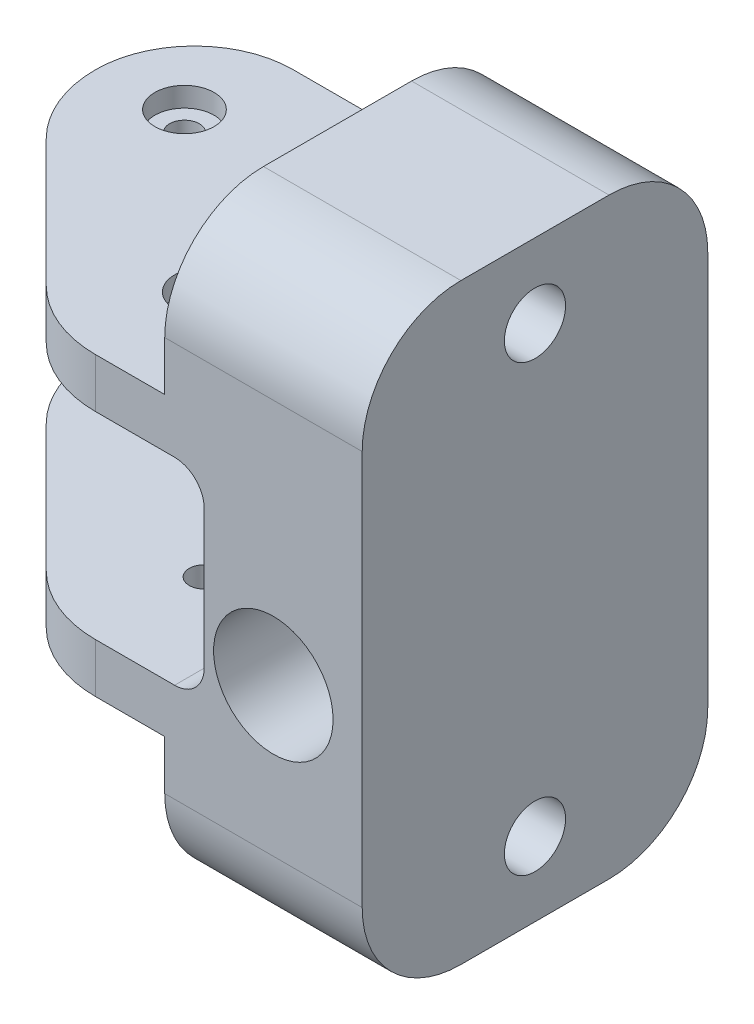
from build123d import *

# Parameters (mm, degrees)
EXTRUDE_1_DEPTH      = 60
SKETCH_2_W           = 32
SKETCH_2_H           = 15
CUT_EXTRUDE_1_DEPTH  = 60
SKETCH_3_R           = 3
CUT_EXTRUDE_2_DEPTH  = 30
CUT_EXTRUDE_3_DEPTH  = 30
CUT_EXTRUDE_4_DEPTH  = 50
SKETCH_6_R           = 5
CUT_EXTRUDE_5_DEPTH  = 50
CUT_EXTRUDE_6_DEPTH  = 50
SKETCH_8_W           = 21
SKETCH_8_H           = 14
SKETCH_8_H_2         = 3
CUT_EXTRUDE_7_DEPTH  = 13
SKETCH_9_W           = 21
SKETCH_9_H           = 3
CUT_EXTRUDE_8_DEPTH  = 13
CUT_EXTRUDE_10_DEPTH = 50
CUT_EXTRUDE_11_DEPTH = 50
SKETCH_15_R          = 1.51
CUT_EXTRUDE_14_DEPTH = 100
CUT_EXTRUDE_START    = -100
SKETCH_16_R          = 1.51
CUT_EXTRUDE_15_DEPTH = 100
SKETCH_17_R          = 1.51
CUT_EXTRUDE_16_DEPTH = 100
SKETCH_18_R          = 1.51
CUT_EXTRUDE_17_DEPTH = 100
SKETCH_21_R          = 3
CUT_EXTRUDE_18_DEPTH = 2
CUT_EXTRUDE_START_2  = -2
SKETCH_22_R          = 3
CUT_EXTRUDE_19_DEPTH = 2
SKETCH_23_R          = 5.05
CUT_EXTRUDE_20_DEPTH = 100
SKETCH_24_R          = 3.05
CUT_EXTRUDE_21_DEPTH = 100
SKETCH_25_R          = 3.05
CUT_EXTRUDE_22_DEPTH = 30
SKETCH_27_R          = 6.05
CUT_EXTRUDE_23_DEPTH = 50
SKETCH_28_R          = 3.05
CUT_EXTRUDE_24_DEPTH = 100
SKETCH_29_R          = 3.05
CUT_EXTRUDE_25_DEPTH = 100
SKETCH_30_R          = 6.05
CUT_EXTRUDE_26_DEPTH = 100
SKETCH_31_W          = 60.79957539
SKETCH_31_H          = 66.624791199
CUT_EXTRUDE_27_DEPTH = 100
SKETCH_32_W          = 19.915773323
SKETCH_32_H          = 3
CUT_EXTRUDE_28_DEPTH = 100
SKETCH_33_R          = 3.05
EXTRUDE_2_DEPTH      = 2
SKETCH_34_R          = 3.1
CUT_EXTRUDE_29_DEPTH = 30


with BuildPart() as part:
    # 草图1 → 凸台-拉伸1 (new body)
    with BuildSketch(Plane(origin=(0, 0, 0), x_dir=(1, 0, 0), z_dir=(0, 1, 0))):
        Polygon((-25, -17.5), (5, -17.5), (25, 2.5), (25, 17.5), (-25, 17.5), align=None)
    extrude_1 = extrude(amount=EXTRUDE_1_DEPTH)

    # 草图2 → 切除-拉伸1 (cut)
    with BuildSketch(Plane(origin=(0, 0, -17.5), x_dir=(-1, 0, 0), z_dir=(0, 0, -1))):
        with Locations((-9, 52.5)):
            Rectangle(SKETCH_2_W, SKETCH_2_H)
        with Locations((-9, 7.5)):
            Rectangle(SKETCH_2_W, SKETCH_2_H)
    cut_extrude_1 = extrude(amount=-CUT_EXTRUDE_1_DEPTH, mode=Mode.SUBTRACT)

    # 草图3 → 切除-拉伸2 (cut)
    with BuildSketch(Plane.ZY.offset(25)):
        with Locations((0, 52.5)):
            Circle(SKETCH_3_R)
        with Locations((0, 7.5)):
            Circle(SKETCH_3_R)
    extrude(amount=-CUT_EXTRUDE_2_DEPTH, mode=Mode.SUBTRACT)

    # 草图4 → 切除-拉伸3 (cut)
    with BuildSketch(Plane.ZY.offset(25)):
        with BuildLine():
            Line((-7.5, 60), (-17.5, 60))
            Line((-17.5, 60), (-17.5, 50))
            ThreePointArc((-17.5, 50), (-14.571067812, 57.071067812), (-7.5, 60))
        make_face()
        with BuildLine():
            Line((17.5, 60), (7.5, 60))
            ThreePointArc((7.5, 60), (14.571067812, 57.071067812), (17.5, 50))
            Line((17.5, 50), (17.5, 60))
        make_face()
        with BuildLine():
            Line((17.5, 0), (17.5, 10))
            ThreePointArc((17.5, 10), (14.571067812, 2.928932188), (7.5, 0))
            Line((7.5, 0), (17.5, 0))
        make_face()
        with BuildLine():
            ThreePointArc((-7.5, 0), (-14.571067812, 2.928932188), (-17.5, 10))
            Line((-17.5, 10), (-17.5, 0))
            Line((-17.5, 0), (-7.5, 0))
        make_face()
    extrude(amount=-CUT_EXTRUDE_3_DEPTH, mode=Mode.SUBTRACT)

    # 草图5 → 切除-拉伸4 (cut)
    with BuildSketch(Plane(origin=(0, 0, -17.5), x_dir=(-1, 0, 0), z_dir=(0, 0, -1))):
        with BuildLine():
            Line((5, 37), (5, 23))
            ThreePointArc((5, 23), (8, 20), (11, 23))
            Line((11, 23), (11, 37))
            ThreePointArc((11, 37), (8, 40), (5, 37))
        make_face()
    cut_extrude_4 = extrude(amount=-CUT_EXTRUDE_4_DEPTH, mode=Mode.SUBTRACT)

    # 草图6 → 切除-拉伸5 (cut)
    with BuildSketch(Plane(origin=(0, 0, -17.5), x_dir=(-1, 0, 0), z_dir=(0, 0, -1))):
        with Locations((18, 25)):
            Circle(SKETCH_6_R)
    extrude(amount=-CUT_EXTRUDE_5_DEPTH, mode=Mode.SUBTRACT)

    # 草图7 → 切除-拉伸6 (cut)
    with BuildSketch(Plane(origin=(0, 0, -17.5), x_dir=(-1, 0, 0), z_dir=(0, 0, -1))):
        with BuildLine():
            ThreePointArc((-5, 37), (-5.878679656, 39.121320344), (-8, 40))
            Line((-8, 40), (-25, 40))
            Line((-25, 40), (-25, 20))
            Line((-25, 20), (-8, 20))
            ThreePointArc((-8, 20), (-5.878679656, 20.878679656), (-5, 23))
            Line((-5, 23), (-5, 30))
            Line((-5, 30), (-5, 37))
        make_face()
    cut_extrude_6 = extrude(amount=-CUT_EXTRUDE_6_DEPTH, mode=Mode.SUBTRACT)

    # 草图8 → 切除-拉伸7 (cut)
    with BuildSketch(Plane(origin=(5, 0, 0), x_dir=(0, 0, -1), z_dir=(1, 0, 0))):
        with Locations((-7, 30)):
            Rectangle(SKETCH_8_W, SKETCH_8_H)
        with Locations((-7, 38.5)):
            Rectangle(SKETCH_8_W, SKETCH_8_H_2)
        with Locations((-7, 21.5)):
            Rectangle(SKETCH_8_W, SKETCH_8_H_2)
    cut_extrude_7 = extrude(amount=-CUT_EXTRUDE_7_DEPTH, mode=Mode.SUBTRACT)

    # 草图9 → 切除-拉伸8 (cut)
    with BuildSketch(Plane.ZY.offset(-5)):
        with Locations((7, 38.5)):
            Rectangle(SKETCH_9_W, SKETCH_9_H)
        with Locations((7, 21.5)):
            Rectangle(SKETCH_9_W, SKETCH_9_H)
    extrude(amount=-CUT_EXTRUDE_8_DEPTH, mode=Mode.SUBTRACT)

    # 草图10 → 切除-拉伸10 (cut)
    with BuildSketch(Plane(origin=(0, 15, 0), x_dir=(-1, 0, 0), z_dir=(0, -1, 0))):
        with BuildLine():
            Line((-25, 17.5), (-25, 7.5))
            ThreePointArc((-25, 7.5), (-22.071067812, 14.571067812), (-15, 17.5))
            Line((-15, 17.5), (-25, 17.5))
        make_face()
        with BuildLine():
            Line((-25, 2.5), (-25, 7.5))
            ThreePointArc((-25, 7.5), (-24.081144675, 2.880602337), (-21.464466094, -1.035533906))
            Line((-21.464466094, -1.035533906), (-25, 2.5))
        make_face()
    cut_extrude_10 = extrude(amount=-CUT_EXTRUDE_10_DEPTH, mode=Mode.SUBTRACT)

    # 草图11 → 切除-拉伸11 (cut)
    with BuildSketch(Plane(origin=(0, 45, 0), x_dir=(1, 0, 0), z_dir=(0, 1, 0))):
        with BuildLine():
            Line((5, -17.5), (8.535533906, -13.964466094))
            ThreePointArc((8.535533906, -13.964466094), (4.619397663, -16.581144675), (0, -17.5))
            Line((0, -17.5), (5, -17.5))
        make_face()
    cut_extrude_11 = extrude(amount=-CUT_EXTRUDE_11_DEPTH, mode=Mode.SUBTRACT)

    # 草图15 → 切除-拉伸14 (cut)
    with BuildSketch(Plane(origin=(0, 20, 0), x_dir=(1, 0, 0), z_dir=(0, 1, 0))):
        with Locations(Location((17, 8.5, 0), (0, 0, 270))):
            Circle(SKETCH_15_R)
    cut_extrude_14 = extrude(amount=-CUT_EXTRUDE_14_DEPTH, mode=Mode.SUBTRACT)

    # 草图16 → 切除-拉伸15 (cut)
    with BuildSketch(Plane.XZ.offset(-15).offset(CUT_EXTRUDE_START)):
        with Locations(Location((17, -8.5, 0), (0, 0, 90))):
            Circle(SKETCH_16_R)
    cut_extrude_15 = extrude(amount=CUT_EXTRUDE_15_DEPTH, mode=Mode.SUBTRACT)

    # 草图17 → 切除-拉伸16 (cut)
    with BuildSketch(Plane(origin=(0, 40, 0), x_dir=(-1, 0, 0), z_dir=(0, -1, 0))):
        with Locations(Location((0, -6.5, 0), (0, 0, 90))):
            Circle(SKETCH_17_R)
    cut_extrude_16 = extrude(amount=-CUT_EXTRUDE_16_DEPTH, mode=Mode.SUBTRACT)

    # 草图18 → 切除-拉伸17 (cut)
    with BuildSketch(Plane(origin=(0, 45, 0), x_dir=(1, 0, 0), z_dir=(0, 1, 0)).offset(CUT_EXTRUDE_START)):
        with Locations(Location((0, -6.5, 0), (0, 0, 90))):
            Circle(SKETCH_18_R)
    cut_extrude_17 = extrude(amount=CUT_EXTRUDE_17_DEPTH, mode=Mode.SUBTRACT)

    # 草图21 → 切除-拉伸18 (cut)
    with BuildSketch(Plane(origin=(0, 45, 0), x_dir=(1, 0, 0), z_dir=(0, 1, 0))):
        with Locations(Location((0, -6.5, 0), (0, 0, 270))):
            Circle(SKETCH_21_R)
        with Locations(Location((17, 8.5, 0), (0, 0, 270))):
            Circle(SKETCH_21_R)
    cut_extrude_18 = extrude(amount=-CUT_EXTRUDE_18_DEPTH, mode=Mode.SUBTRACT)

    # 草图22 → 切除-拉伸19 (cut)
    with BuildSketch(Plane(origin=(0, 15, 0), x_dir=(-1, 0, 0), z_dir=(0, -1, 0)).offset(CUT_EXTRUDE_START_2)):
        with Locations(Location((0, -6.5, 0), (0, 0, 270))):
            Circle(SKETCH_22_R)
        with Locations(Location((-17, 8.5, 0), (0, 0, 270))):
            Circle(SKETCH_22_R)
    cut_extrude_19 = extrude(amount=CUT_EXTRUDE_19_DEPTH, mode=Mode.SUBTRACT)

    # 草图23 → 切除-拉伸20 (cut)
    with BuildSketch(Plane(origin=(0, 0, -17.5), x_dir=(-1, 0, 0), z_dir=(0, 0, -1))):
        with Locations((18, 25)):
            Circle(SKETCH_23_R)
    extrude(amount=-CUT_EXTRUDE_20_DEPTH, mode=Mode.SUBTRACT)

    # 草图24 → 切除-拉伸21 (cut)
    with BuildSketch(Plane.ZY.offset(25)):
        with Locations((0, 52.5)):
            Circle(SKETCH_24_R)
    extrude(amount=-CUT_EXTRUDE_21_DEPTH, mode=Mode.SUBTRACT)

    # 草图25 → 切除-拉伸22 (cut)
    with BuildSketch(Plane.ZY.offset(25)):
        with Locations((0, 7.5)):
            Circle(SKETCH_25_R)
    extrude(amount=-CUT_EXTRUDE_22_DEPTH, mode=Mode.SUBTRACT)

    # 草图27 → 切除-拉伸23 (cut)
    with BuildSketch(Plane(origin=(0, 0, -17.5), x_dir=(-1, 0, 0), z_dir=(0, 0, -1))):
        with Locations((18, 25)):
            Circle(SKETCH_27_R)
    extrude(amount=-CUT_EXTRUDE_23_DEPTH, mode=Mode.SUBTRACT)

    # 镜向4: 凸台-拉伸1, 切除-拉伸1, 切除-拉伸4, 切除-拉伸6, 切除-拉伸7, 切除-拉伸10, 切除-拉伸11, 切除-拉伸14, 切除-拉伸15, 切除-拉伸16, 切除-拉伸17, 切除-拉伸18, 切除-拉伸19 across plane
    add(extrude_1.mirror(Plane(origin=(-25, 60, 17.5), x_dir=(0, 0, 1), z_dir=(-1, 0, 0))))
    add(cut_extrude_1.mirror(Plane(origin=(-25, 60, 17.5), x_dir=(0, 0, 1), z_dir=(-1, 0, 0))), mode=Mode.SUBTRACT)
    add(cut_extrude_4.mirror(Plane(origin=(-25, 60, 17.5), x_dir=(0, 0, 1), z_dir=(-1, 0, 0))), mode=Mode.SUBTRACT)
    add(cut_extrude_6.mirror(Plane(origin=(-25, 60, 17.5), x_dir=(0, 0, 1), z_dir=(-1, 0, 0))), mode=Mode.SUBTRACT)
    add(cut_extrude_7.mirror(Plane(origin=(-25, 60, 17.5), x_dir=(0, 0, 1), z_dir=(-1, 0, 0))), mode=Mode.SUBTRACT)
    add(cut_extrude_10.mirror(Plane(origin=(-25, 60, 17.5), x_dir=(0, 0, 1), z_dir=(-1, 0, 0))), mode=Mode.SUBTRACT)
    add(cut_extrude_11.mirror(Plane(origin=(-25, 60, 17.5), x_dir=(0, 0, 1), z_dir=(-1, 0, 0))), mode=Mode.SUBTRACT)
    add(cut_extrude_14.mirror(Plane(origin=(-25, 60, 17.5), x_dir=(0, 0, 1), z_dir=(-1, 0, 0))), mode=Mode.SUBTRACT)
    add(cut_extrude_15.mirror(Plane(origin=(-25, 60, 17.5), x_dir=(0, 0, 1), z_dir=(-1, 0, 0))), mode=Mode.SUBTRACT)
    add(cut_extrude_16.mirror(Plane(origin=(-25, 60, 17.5), x_dir=(0, 0, 1), z_dir=(-1, 0, 0))), mode=Mode.SUBTRACT)
    add(cut_extrude_17.mirror(Plane(origin=(-25, 60, 17.5), x_dir=(0, 0, 1), z_dir=(-1, 0, 0))), mode=Mode.SUBTRACT)
    add(cut_extrude_18.mirror(Plane(origin=(-25, 60, 17.5), x_dir=(0, 0, 1), z_dir=(-1, 0, 0))), mode=Mode.SUBTRACT)
    add(cut_extrude_19.mirror(Plane(origin=(-25, 60, 17.5), x_dir=(0, 0, 1), z_dir=(-1, 0, 0))), mode=Mode.SUBTRACT)

    # 草图28 → 切除-拉伸24 (cut)
    with BuildSketch(Plane(origin=(-7, 0, 0), x_dir=(0, 0, -1), z_dir=(1, 0, 0)).offset(CUT_EXTRUDE_START)):
        with Locations(Location((0, 7.5, 0), (0, 0, 180))):
            Circle(SKETCH_28_R)
        with BuildLine():
            Line((-17.5, 0), (-17.5, 10))
            ThreePointArc((-17.5, 10), (-14.571067812, 2.928932188), (-7.5, 0))
            Line((-7.5, 0), (-17.5, 0))
        make_face()
        with BuildLine():
            Line((7.5, 0), (17.5, 0))
            Line((17.5, 0), (17.5, 10))
            ThreePointArc((17.5, 10), (14.571067812, 2.928932188), (7.5, 0))
        make_face()
    extrude(amount=CUT_EXTRUDE_24_DEPTH, mode=Mode.SUBTRACT)

    # 草图29 → 切除-拉伸25 (cut)
    with BuildSketch(Plane(origin=(-7, 0, 0), x_dir=(0, 0, -1), z_dir=(1, 0, 0)).offset(CUT_EXTRUDE_START)):
        with Locations(Location((0, 52.5, 0), (0, 0, 180))):
            Circle(SKETCH_29_R)
        with BuildLine():
            Line((17.5, 60), (17.5, 50))
            ThreePointArc((17.5, 50), (14.571067812, 57.071067812), (7.5, 60))
            Line((7.5, 60), (17.5, 60))
        make_face()
        with BuildLine():
            Line((-17.5, 50), (-17.5, 60))
            Line((-17.5, 60), (-7.5, 60))
            ThreePointArc((-7.5, 60), (-14.571067812, 57.071067812), (-17.5, 50))
        make_face()
    extrude(amount=CUT_EXTRUDE_25_DEPTH, mode=Mode.SUBTRACT)

    # 草图30 → 切除-拉伸26 (cut)
    with BuildSketch(Plane.XY.offset(17.5)):
        with Locations((-32, 25)):
            Circle(SKETCH_30_R)
    extrude(amount=-CUT_EXTRUDE_26_DEPTH, mode=Mode.SUBTRACT)

    # 草图31 → 切除-拉伸27 (cut)
    with BuildSketch(Plane.XY.offset(17.5)):
        with Locations((5.399787695, 26.687604401)):
            Rectangle(SKETCH_31_W, SKETCH_31_H)
    extrude(amount=-CUT_EXTRUDE_27_DEPTH, mode=Mode.SUBTRACT)

    # 草图32 → 切除-拉伸28 (cut)
    with BuildSketch(Plane(origin=(-55, 0, 0), x_dir=(0, 0, -1), z_dir=(1, 0, 0))):
        with Locations((-6.457886661, 38.5)):
            Rectangle(SKETCH_32_W, SKETCH_32_H)
        with Locations((-6.457886661, 21.5)):
            Rectangle(SKETCH_32_W, SKETCH_32_H)
    extrude(amount=-CUT_EXTRUDE_28_DEPTH, mode=Mode.SUBTRACT)

    # 草图33 → 凸台-拉伸2 (add)
    with BuildSketch(Plane(origin=(-25, 0, 0), x_dir=(0, 0, -1), z_dir=(1, 0, 0))):
        with BuildLine():
            Line((-7.5, 60), (7.5, 60))
            ThreePointArc((7.5, 60), (14.571067812, 57.071067812), (17.5, 50))
            Line((17.5, 50), (17.5, 10))
            ThreePointArc((17.5, 10), (14.571067812, 2.928932188), (7.5, 0))
            Line((7.5, 0), (-7.5, 0))
            ThreePointArc((-7.5, 0), (-14.571067812, 2.928932188), (-17.5, 10))
            Line((-17.5, 10), (-17.5, 50))
            ThreePointArc((-17.5, 50), (-14.571067812, 57.071067812), (-7.5, 60))
        make_face()
        with Locations(Location((0, 7.5, 0), (0, 0, 180))):
            Circle(SKETCH_33_R, mode=Mode.SUBTRACT)
        with Locations(Location((0, 52.5, 0), (0, 0, 180))):
            Circle(SKETCH_33_R, mode=Mode.SUBTRACT)
    extrude(amount=EXTRUDE_2_DEPTH)

    # 草图34 → 切除-拉伸29 (cut)
    with BuildSketch(Plane(origin=(-23, 0, 0), x_dir=(0, 0, -1), z_dir=(1, 0, 0))):
        with Locations((0, 52.5)):
            Circle(SKETCH_34_R)
        with Locations((0, 7.5)):
            Circle(SKETCH_34_R)
    extrude(amount=-CUT_EXTRUDE_29_DEPTH, mode=Mode.SUBTRACT)


solid = part.part
